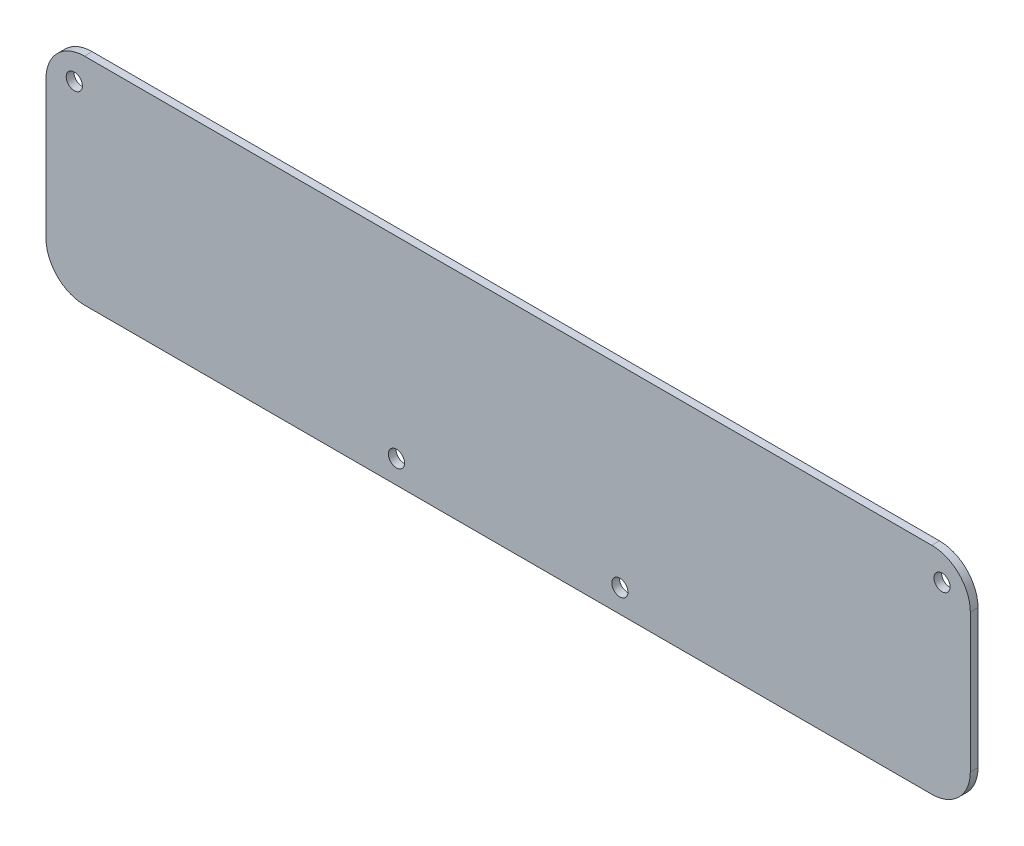
from build123d import *

# Parameters (mm, degrees)
SKETCH3_R           = 1.05
BOSS_EXTRUDE1_DEPTH = 1


with BuildPart() as part:
    # Sketch3 → Boss-Extrude1 (new body)
    with BuildSketch(Plane.XY):
        with BuildLine():
            Line((0, 14.052488348), (55, 14.052488348))
            ThreePointArc((55, 14.052488348), (58.535533906, 12.588022254), (60, 9.052488348))
            Line((60, 9.052488348), (60, -8.947511652))
            ThreePointArc((60, -8.947511652), (58.535533906, -12.483045558), (55, -13.947511652))
            Line((55, -13.947511652), (0, -13.947511652))
            Line((0, -13.947511652), (-55, -13.947511652))
            ThreePointArc((-55, -13.947511652), (-58.535533906, -12.483045558), (-60, -8.947511652))
            Line((-60, -8.947511652), (-60, 9.052488348))
            ThreePointArc((-60, 9.052488348), (-58.535533906, 12.588022254), (-55, 14.052488348))
            Line((-55, 14.052488348), (0, 14.052488348))
        make_face()
        with Locations((-56.327907587, 10.548035553)):
            Circle(SKETCH3_R, mode=Mode.SUBTRACT)
        with Locations((56.327907587, 10.548035553)):
            Circle(SKETCH3_R, mode=Mode.SUBTRACT)
        with Locations((-14.5, -10.947511652)):
            Circle(SKETCH3_R, mode=Mode.SUBTRACT)
        with Locations((14.5, -10.947511652)):
            Circle(SKETCH3_R, mode=Mode.SUBTRACT)
    extrude(amount=BOSS_EXTRUDE1_DEPTH)


solid = part.part
